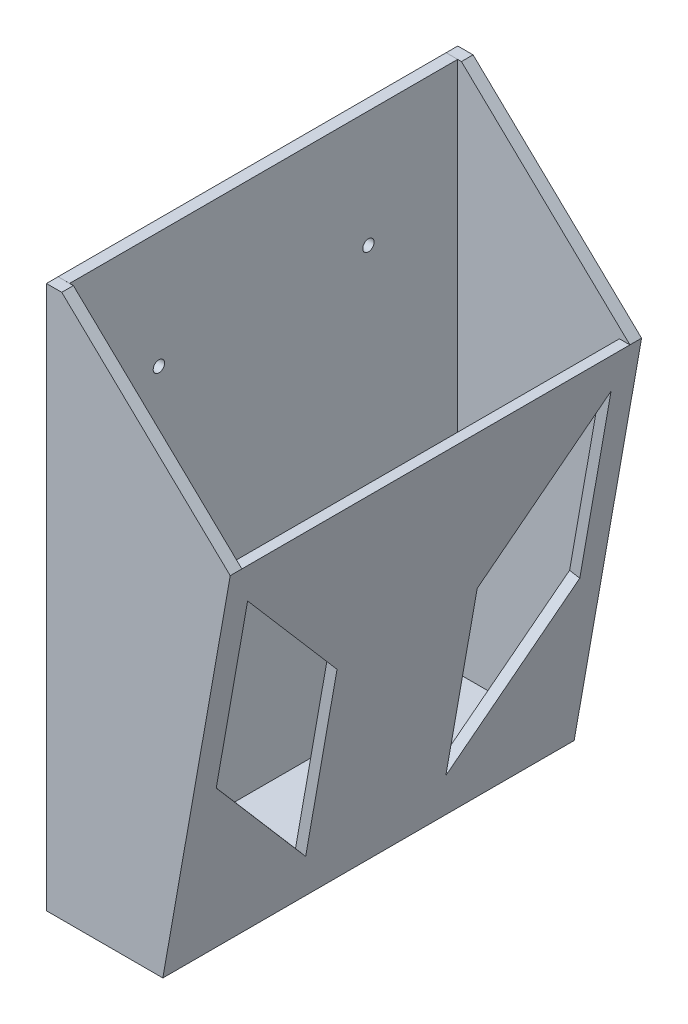
from build123d import *

# Parameters (mm, degrees)
BOSS_EXTRU_1_DEPTH         = 3
BOSS_EXTRU_2_DEPTH         = 100
R_P_TITION_LIN_AIRE1_COUNT = 2
R_P_TITION_LIN_AIRE1_PITCH = 103
ESQUISSE5_W                = 2.97567345
ESQUISSE5_H                = 100
BOSS_EXTRU_3_DEPTH         = 137
ESQUISSE6_W                = 2.705773981
ESQUISSE6_H                = 100
ESQUISSE9_R                = 1.462141601
ENL_V_MAT_EXTRU_8_DEPTH    = 10
ENL_V_MAT_EXTRU_10_DEPTH   = 10


with BuildPart() as part:
    # Esquisse2 → Boss.-Extru.1 (new body)
    with BuildSketch(Plane.XY):
        Polygon((0, 0), (0, 140), (3.942801894, 140), (47.364817767, 98.480775301), (30, 0), align=None)
    boss_extru_1 = extrude(amount=BOSS_EXTRU_1_DEPTH)

    # Esquisse4 → Boss.-Extru.2 (add)
    with BuildSketch(Plane.XY.offset(3)):
        Polygon((0, 0), (0, 3.006117571), (30.530059635, 3.006117571), (30, 0), align=None)
    extrude(amount=BOSS_EXTRU_2_DEPTH)

    # Répétition linéaire1: Boss.-Extru.1 ×2
    with Locations(*[(0, 0, i * R_P_TITION_LIN_AIRE1_PITCH) for i in range(1, R_P_TITION_LIN_AIRE1_COUNT)]):
        add(boss_extru_1)

    # Esquisse5 → Boss.-Extru.3 (add)
    with BuildSketch(Plane(origin=(0, 3.006117571, 0), x_dir=(1, 0, 0), z_dir=(0, 1, 0))):
        with Locations((1.487836725, -53)):
            Rectangle(ESQUISSE5_W, ESQUISSE5_H)
    extrude(amount=BOSS_EXTRU_3_DEPTH)

    # Balayage1: sweep along a curve in space
    with BuildLine() as balayage1_path:
        Line((30.530059635, 3.006117571, 103), (47.364817767, 98.480775301, 103))
    # Esquisse6 → Balayage1 (sweep)
    with BuildSketch(Plane(origin=(0, 3.006117571, 0), x_dir=(1, 0, 0), z_dir=(0, 1, 0))):
        with Locations((29.177172645, -53)):
            Rectangle(ESQUISSE6_W, ESQUISSE6_H)
    sweep(path=balayage1_path.line)

    # Esquisse9 → Enlèv. mat.-Extru.8 (cut)
    with BuildSketch(Plane(origin=(2.97567345, 0, 0), x_dir=(0, 0, -1), z_dir=(1, 0, 0))):
        with Locations((-80, 110)):
            Circle(ESQUISSE9_R)
    enl_v_mat_extru_8 = extrude(amount=-ENL_V_MAT_EXTRU_8_DEPTH, mode=Mode.SUBTRACT)

    # Symétrie3: Enlèv. mat.-Extru.8 across plane
    add(enl_v_mat_extru_8.mirror(Plane.XY.offset(53)), mode=Mode.SUBTRACT)

    # Esquisse11 → Enlèv. mat.-Extru.10 (cut)
    with BuildSketch(Plane(origin=(29.095389312, -5.13030215, 0), x_dir=(0, 0, -1), z_dir=(0.9848077530122089, -0.17364817766692642, 0))):
        Polygon((-6.160430803, 48.968309083), (-6.160430803, 95.489627834), (-34.939480046, 62.478304571), (-34.939480046, 15.95698582), align=None)
    enl_v_mat_extru_10 = extrude(amount=-ENL_V_MAT_EXTRU_10_DEPTH, mode=Mode.SUBTRACT)

    # Symétrie4: Enlèv. mat.-Extru.10 across plane
    add(enl_v_mat_extru_10.mirror(Plane.XY.offset(53)), mode=Mode.SUBTRACT)


solid = part.part
